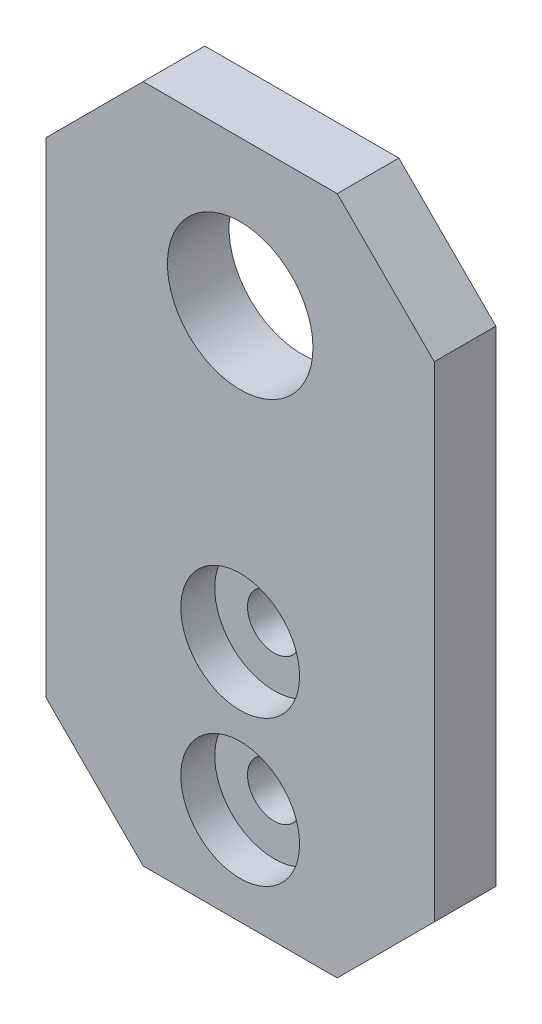
from build123d import *

# Parameters (mm, degrees)
SKETCH1_W                               = 40
SKETCH1_H                               = 70
SKETCH1_R                               = 7.5
BOSS_EXTRUDE1_DEPTH                     = 6.35
CBORE_FOR_M5_HEX_HEAD_BOLT1_D           = 5.5
CBORE_FOR_M5_HEX_HEAD_BOLT1_CBORE_D     = 12.238
CBORE_FOR_M5_HEX_HEAD_BOLT1_CBORE_DEPTH = 3.5
CHAMFER1_SIZE                           = 10


with BuildPart() as part:
    # Sketch1 → Boss-Extrude1 (new body)
    with BuildSketch(Plane.XY):
        Rectangle(SKETCH1_W, SKETCH1_H)
        with Locations((0, 20)):
            Circle(SKETCH1_R, mode=Mode.SUBTRACT)
    extrude(amount=BOSS_EXTRUDE1_DEPTH)

    # CBORE for M5 Hex Head Bolt1 (through all)
    with Locations(Plane.XY.offset(6.35)):
        with Locations((0, -10), (0, -25)):
            CounterBoreHole(CBORE_FOR_M5_HEX_HEAD_BOLT1_D / 2, CBORE_FOR_M5_HEX_HEAD_BOLT1_CBORE_D / 2, CBORE_FOR_M5_HEX_HEAD_BOLT1_CBORE_DEPTH)

    # Chamfer1
    chamfer1_edges = [part.edges().sort_by_distance(p)[0] for p in [
        (-20, 35, 3.175),
        (20, 35, 3.175),
        (20, -35, 3.175),
        (-20, -35, 3.175),
    ]]
    chamfer(chamfer1_edges, length=CHAMFER1_SIZE)


solid = part.part
